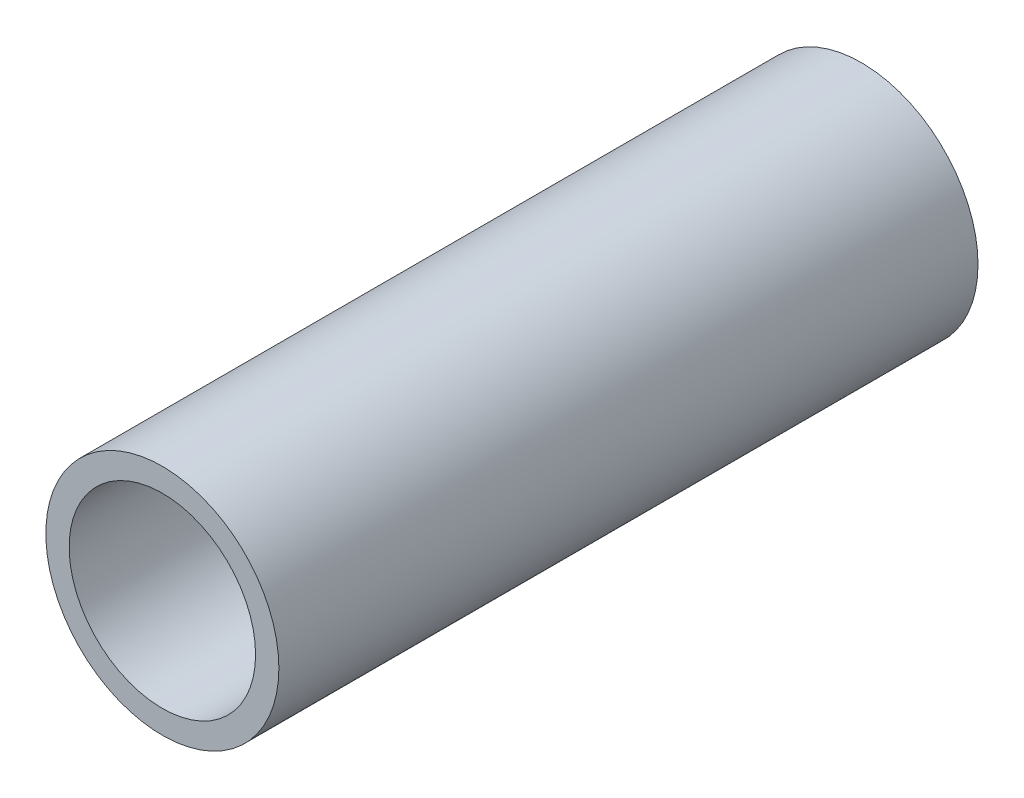
from build123d import *

# Parameters (mm, degrees)
SKETCH1_R           = 12.5
SKETCH1_R_2         = 10
BOSS_EXTRUDE1_DEPTH = 37.5


with BuildPart() as part:
    # Sketch1 → Boss-Extrude1 (new, symmetric)
    with BuildSketch(Plane.XY):
        Circle(SKETCH1_R)
        Circle(SKETCH1_R_2, mode=Mode.SUBTRACT)
    extrude(amount=BOSS_EXTRUDE1_DEPTH, both=True)


solid = part.part
